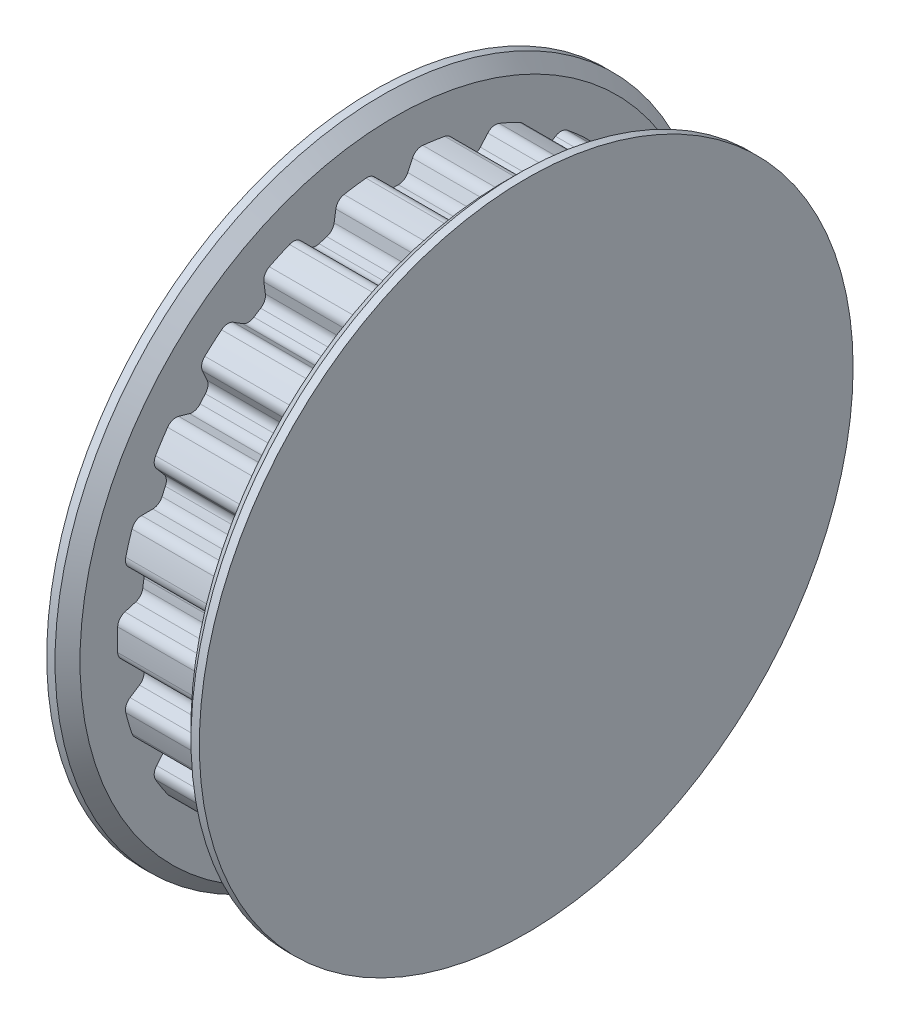
from build123d import *

# Parameters (mm, degrees)
SKETCH3_R                = 16.63715644
BOSS_EXTRUDE1_DEPTH      = 3.33375
CUT_EXTRUDE1_DEPTH       = 3.33375
FILLET1_R                = 0.61
CIRPATTERN1_COUNT        = 22
FILLET1_OF_CIRPATTERN1_R = 0.61
BOSS_EXTRUDE4_START      = 3.33375
SKETCH8_R                = 19.63715644
BOSS_EXTRUDE4_DEPTH      = 1.25
BOSS_EXTRUDE5_START      = -4.58375
SKETCH8_2_R              = 19.63715644
BOSS_EXTRUDE5_DEPTH      = 1.25
CHAMFER1_SIZE            = 0.75


with BuildPart() as part:
    # Sketch3 → Boss-Extrude1 (new, symmetric)
    with BuildSketch(Plane(origin=(0, 0, 0), x_dir=(0, 0, -1), z_dir=(1, 0, 0))):
        with Locations(Location((0, 0, 0), (0, 0, 180))):
            Circle(SKETCH3_R)
    extrude(amount=BOSS_EXTRUDE1_DEPTH, both=True)

    # Sketch4 → Cut-Extrude1 (cut, symmetric)
    with BuildSketch(Plane(origin=(0, 0, 0), x_dir=(0, 0, -1), z_dir=(1, 0, 0))):
        with BuildLine():
            Line((-1.271319993, 16.588511684), (-0.635, 15.223919054))
            ThreePointArc((-0.635, 15.223919054), (0, 15.23715644), (0.635, 15.223919054))
            Line((0.635, 15.223919054), (1.271319993, 16.588511684))
            ThreePointArc((1.271319993, 16.588511684), (0, 16.63715644), (-1.271319993, 16.588511684))
        make_face()
    cut_extrude1 = extrude(amount=CUT_EXTRUDE1_DEPTH, both=True, mode=Mode.SUBTRACT)

    # Fillet1
    fillet1_edges = [part.edges().sort_by_distance(p)[0] for p in [
        (0, 16.588511684, -1.271319993),
        (0, 15.223919054, -0.635),
        (0, 15.223919054, 0.635),
        (0, 16.588511684, 1.271319993),
    ]]
    fillet(fillet1_edges, radius=FILLET1_R)

    # CirPattern1: Cut-Extrude1 ×22 about axis
    cirpattern1_axis = Axis((0, 0, 0), (1, 0, 0))
    for i in range(1, CIRPATTERN1_COUNT):
        add(cut_extrude1.rotate(cirpattern1_axis, i * 360 / CIRPATTERN1_COUNT), mode=Mode.SUBTRACT)

    # Fillet1 of CirPattern1
    fillet1_of_cirpattern1_edges = [part.edges().sort_by_distance(p)[0] for p in [
        (0, 16.274732636, 3.45370121),
        (0, 14.786143537, 3.679795602),
        (0, 14.42834319, 4.898351679),
        (0, 15.558388171, 5.893346412),
        (0, 14.642471539, 7.898924081),
        (0, 13.150482607, 7.696476049),
        (0, 12.463868769, 8.764868036),
        (0, 13.267816578, 10.037928953),
        (0, 11.82396448, 11.7042231),
        (0, 10.449447785, 11.089633779),
        (0, 9.489645826, 11.921306911),
        (0, 9.902365392, 13.369298188),
        (0, 8.047550139, 14.561315571),
        (0, 6.901860849, 13.584375333),
        (0, 5.746628215, 14.1119524),
        (0, 5.734683455, 15.617566394),
        (0, 3.619171146, 16.238736854),
        (0, 2.795126194, 14.978591587),
        (0, 1.538052963, 15.159331432),
        (0, 1.102411569, 16.600592253),
        (0, -1.102411569, 16.600592253),
        (0, -1.538052963, 15.159331432),
        (0, -2.795126194, 14.978591587),
        (0, -3.619171146, 16.238736854),
        (0, -5.734683455, 15.617566394),
        (0, -5.746628215, 14.1119524),
        (0, -6.901860849, 13.584375333),
        (0, -8.047550139, 14.561315571),
        (0, -9.902365392, 13.369298188),
        (0, -9.489645826, 11.921306911),
        (0, -10.449447785, 11.089633779),
        (0, -11.82396448, 11.7042231),
        (0, -13.267816578, 10.037928953),
        (0, -12.463868769, 8.764868036),
        (0, -13.150482607, 7.696476049),
        (0, -14.642471539, 7.898924081),
        (0, -15.558388171, 5.893346412),
        (0, -14.42834319, 4.898351679),
        (0, -14.786143537, 3.679795602),
        (0, -16.274732636, 3.45370121),
        (0, -16.588511684, 1.271319993),
        (0, -15.223919054, 0.635),
        (0, -15.223919054, -0.635),
        (0, -16.588511684, -1.271319993),
        (0, -16.274732636, -3.45370121),
        (0, -14.786143537, -3.679795602),
        (0, -14.42834319, -4.898351679),
        (0, -15.558388171, -5.893346412),
        (0, -14.642471539, -7.898924081),
        (0, -13.150482607, -7.696476049),
        (0, -12.463868769, -8.764868036),
        (0, -13.267816578, -10.037928953),
        (0, -11.82396448, -11.7042231),
        (0, -10.449447785, -11.089633779),
        (0, -9.489645826, -11.921306911),
        (0, -9.902365392, -13.369298188),
        (0, -8.047550139, -14.561315571),
        (0, -6.901860849, -13.584375333),
        (0, -5.746628215, -14.1119524),
        (0, -5.734683455, -15.617566394),
        (0, -3.619171146, -16.238736854),
        (0, -2.795126194, -14.978591587),
        (0, -1.538052963, -15.159331432),
        (0, -1.102411569, -16.600592253),
        (0, 1.102411569, -16.600592253),
        (0, 1.538052963, -15.159331432),
        (0, 2.795126194, -14.978591587),
        (0, 3.619171146, -16.238736854),
        (0, 5.734683455, -15.617566394),
        (0, 5.746628215, -14.1119524),
        (0, 6.901860849, -13.584375333),
        (0, 8.047550139, -14.561315571),
        (0, 9.902365392, -13.369298188),
        (0, 9.489645826, -11.921306911),
        (0, 10.449447785, -11.089633779),
        (0, 11.82396448, -11.7042231),
        (0, 13.267816578, -10.037928953),
        (0, 12.463868769, -8.764868036),
        (0, 13.150482607, -7.696476049),
        (0, 14.642471539, -7.898924081),
        (0, 15.558388171, -5.893346412),
        (0, 14.42834319, -4.898351679),
        (0, 14.786143537, -3.679795602),
        (0, 16.274732636, -3.45370121),
    ]]
    fillet(fillet1_of_cirpattern1_edges, radius=FILLET1_OF_CIRPATTERN1_R)

    # Sketch8 → Boss-Extrude4 (add)
    with BuildSketch(Plane(origin=(0, 0, 0), x_dir=(0, 0, -1), z_dir=(1, 0, 0)).offset(BOSS_EXTRUDE4_START)):
        Circle(SKETCH8_R)
    extrude(amount=BOSS_EXTRUDE4_DEPTH)

    # Sketch8<2> → Boss-Extrude5 (add)
    with BuildSketch(Plane(origin=(0, 0, 0), x_dir=(0, 0, -1), z_dir=(1, 0, 0)).offset(BOSS_EXTRUDE5_START)):
        Circle(SKETCH8_2_R)
    extrude(amount=BOSS_EXTRUDE5_DEPTH)

    # Chamfer1
    chamfer1_edges = [part.edges().sort_by_distance(p)[0] for p in [
        (3.33375, 0, 19.63715644),
        (-3.33375, 0, 19.63715644),
    ]]
    chamfer(chamfer1_edges, length=CHAMFER1_SIZE)


solid = part.part
